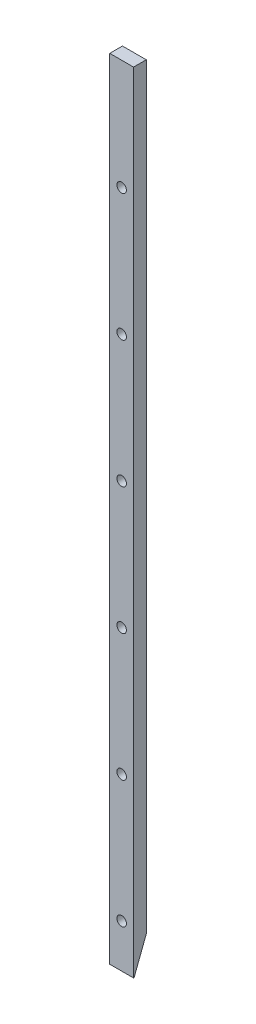
from build123d import *

# Parameters (mm, degrees)
SKETCH1_W           = 15
SKETCH1_H           = 496.82
BOSS_EXTRUDE1_DEPTH = 4
SKETCH2_R           = 3
CUT_EXTRUDE1_DEPTH  = 8
CHAMFER1_SIZE       = 20
CHAMFER1_SIZE2      = 7.677280701
LPATTERN1_COUNT     = 6
LPATTERN1_PITCH     = 80
CHAMFER3_SIZE       = 3


with BuildPart() as part:
    # Sketch1 → Boss-Extrude1 (new, symmetric)
    with BuildSketch(Plane.XY):
        Rectangle(SKETCH1_W, SKETCH1_H)
    extrude(amount=BOSS_EXTRUDE1_DEPTH, both=True)

    # Sketch2 → Cut-Extrude1 (cut)
    with BuildSketch(Plane.XY.offset(4)):
        with Locations((0, 178.95225561)):
            Circle(SKETCH2_R)
    cut_extrude1 = extrude(amount=-CUT_EXTRUDE1_DEPTH, mode=Mode.SUBTRACT)

    # Chamfer1
    chamfer1_edges = [part.edges().sort_by_distance(p)[0] for p in [
        (0, -248.41, -4),
    ]]
    chamfer1_side = [part.faces().sort_by_distance(p)[0] for p in [
        (0, -0.68153803, -4),
    ]]
    chamfer(chamfer1_edges, length=CHAMFER1_SIZE, length2=CHAMFER1_SIZE2, reference=chamfer1_side[0])

    # LPattern1: Cut-Extrude1 ×6
    with Locations(*[(0, -i * LPATTERN1_PITCH, 0) for i in range(1, LPATTERN1_COUNT)]):
        add(cut_extrude1, mode=Mode.SUBTRACT)

    # Chamfer3
    chamfer3_edges = [part.edges().sort_by_distance(p)[0] for p in [
        (-3, 178.95225561, -4),
        (-3, 98.95225561, -4),
        (-3, 18.95225561, -4),
        (-3, -61.04774439, -4),
        (-3, -141.04774439, -4),
        (-3, -221.04774439, -4),
    ]]
    chamfer(chamfer3_edges, length=CHAMFER3_SIZE)


solid = part.part
